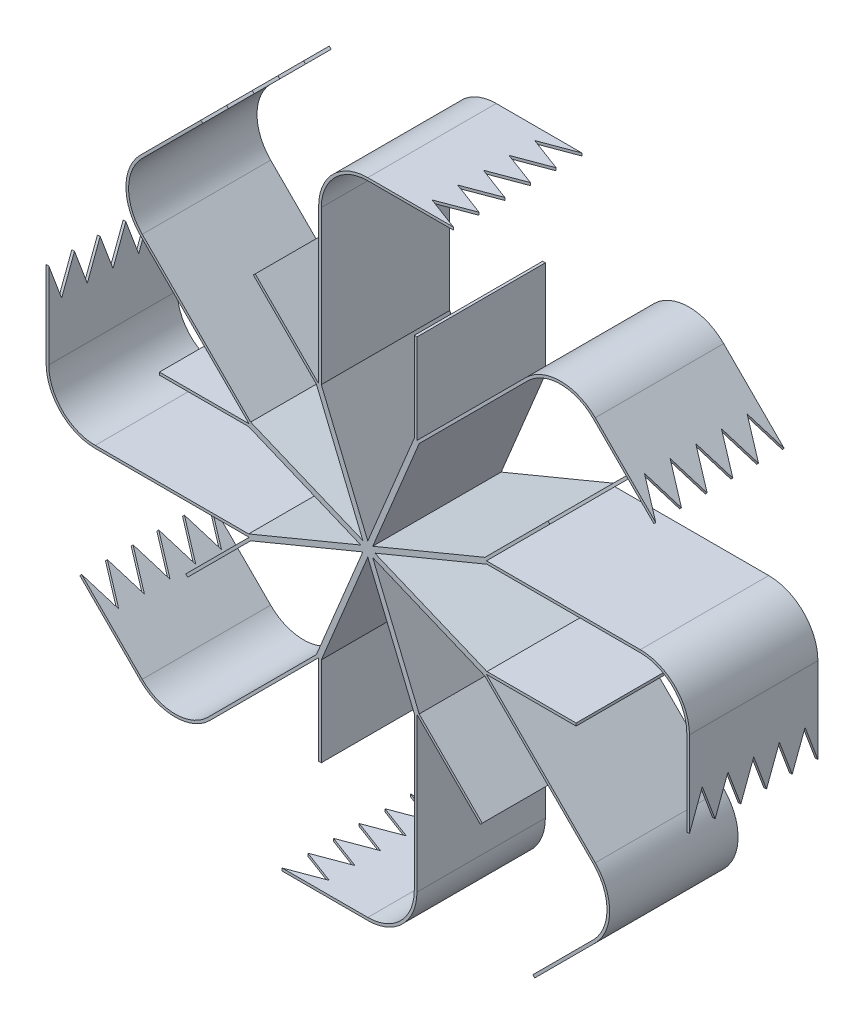
from build123d import *

# Parameters (mm, degrees)
BOSS_EXTRUDE1_DEPTH = 76.2
CUT_EXTRUDE2_START  = -1.5875
CUT_EXTRUDE2_DEPTH  = 1.5875
CIRPATTERN10_COUNT  = 8


with BuildPart() as part:
    # Sketch2 → Boss-Extrude1 (new body)
    with BuildSketch(Plane.XY):
        with BuildLine():
            Line((0, 0), (29.160477546, -70.399620377))
            Line((29.160477546, -70.399620377), (29.160477546, -123.606903324))
            Line((29.160477546, -123.606903324), (29.160477546, -161.706903324))
            ThreePointArc((29.160477546, -161.706903324), (20.619571416, -182.326474739), (0, -190.86738087))
            Line((0, -190.86738087), (-50.8, -190.86738087))
            Line((-50.8, -190.86738087), (-50.8, -189.27988087))
            Line((-50.8, -189.27988087), (0, -189.27988087))
            ThreePointArc((0, -189.27988087), (19.4970394, -181.203942724), (27.572977546, -161.706903324))
            Line((27.572977546, -161.706903324), (27.572977546, -123.606903324))
            Line((27.572977546, -123.606903324), (27.572977546, -70.715393761))
            Line((27.572977546, -70.715393761), (0, -4.148337413))
            Line((0, -4.148337413), (-27.572977546, -70.715393761))
            Line((-27.572977546, -70.715393761), (-27.572977546, -123.606903324))
            Line((-27.572977546, -123.606903324), (-29.160477546, -123.606903324))
            Line((-29.160477546, -123.606903324), (-29.160477546, -70.399620377))
            Line((-29.160477546, -70.399620377), (0, 0))
        make_face()
    boss_extrude1 = extrude(amount=BOSS_EXTRUDE1_DEPTH)

    # Sketch5 → Cut-Extrude2 (cut)
    with BuildSketch(Plane.XZ.offset(190.86738087).offset(CUT_EXTRUDE2_START)):
        Polygon((-50.8, 76.2), (-30.48, 68.58), (-50.8, 60.96), (-30.48, 53.34), (-50.8, 45.72), (-30.48, 38.1), (-50.8, 30.48), (-30.48, 22.86), (-50.8, 15.24), (-30.48, 7.62), (-50.8, 0), (-53.34, 0), (-53.34, 76.2), align=None)
    cut_extrude2 = extrude(amount=CUT_EXTRUDE2_DEPTH, mode=Mode.SUBTRACT)

    # CirPattern10: Boss-Extrude1, Cut-Extrude2 ×8 about axis
    cirpattern10_axis = Axis((0, 0, 0), (0, 0, 1))
    add([boss_extrude1.rotate(cirpattern10_axis, i * 360 / CIRPATTERN10_COUNT) for i in range(1, CIRPATTERN10_COUNT)])
    add([cut_extrude2.rotate(cirpattern10_axis, i * 360 / CIRPATTERN10_COUNT) for i in range(1, CIRPATTERN10_COUNT)], mode=Mode.SUBTRACT)


solid = part.part
